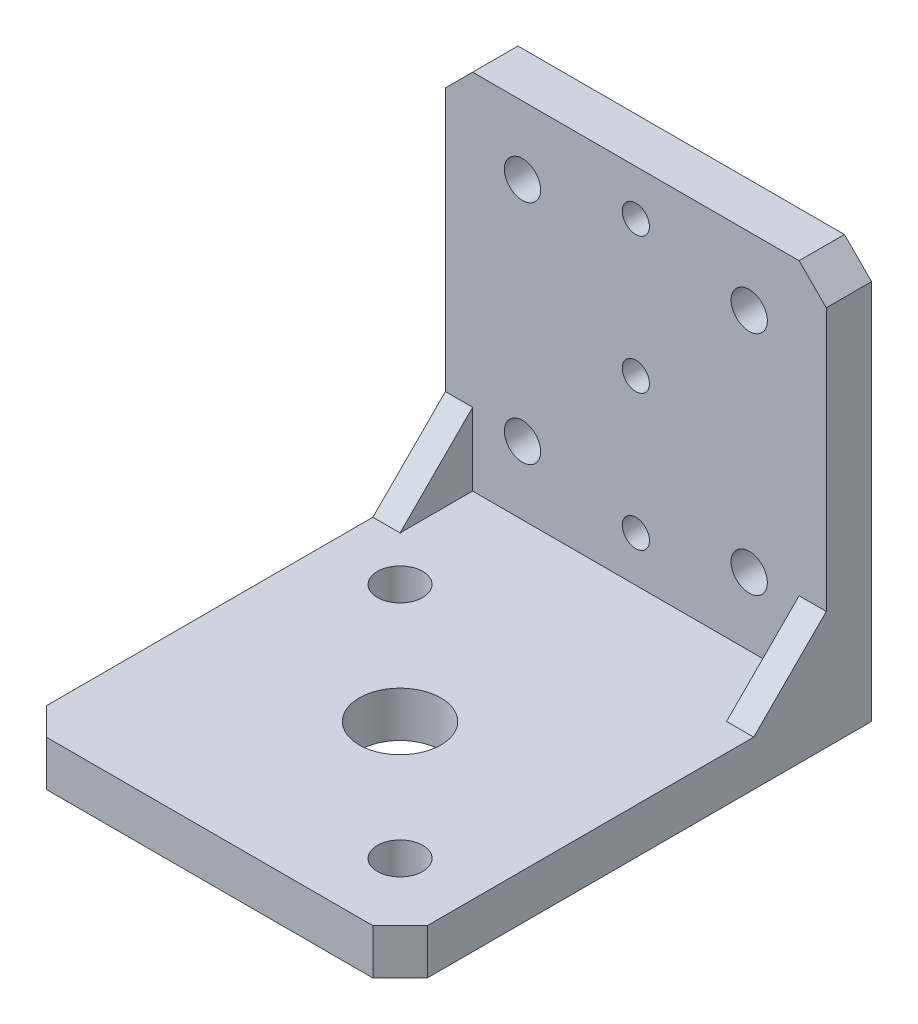
from build123d import *

# Parameters (mm, degrees)
SKETCH1_W           = 42
SKETCH1_H           = 47
BOSS_EXTRUDE1_DEPTH = 5
SKETCH4_W           = 42
SKETCH4_H           = 45
BOSS_EXTRUDE2_DEPTH = 5
BOSS_EXTRUDE3_DEPTH = 3
BOSS_EXTRUDE4_DEPTH = 3
SKETCH2_R           = 2.5
SKETCH2_R_2         = 4.5
CUT_EXTRUDE1_DEPTH  = 54.415821626
SKETCH9_R           = 2
CUT_EXTRUDE4_DEPTH  = 69.373971656
CHAMFER2_SIZE       = 3
CUT_EXTRUDE5_REACH  = 73.903
SKETCH10_R          = 1.5


with BuildPart() as part:
    # Sketch1 → Boss-Extrude1 (new body)
    with BuildSketch(Plane(origin=(0, 0, 0), x_dir=(1, 0, 0), z_dir=(0, 1, 0))):
        Rectangle(SKETCH1_W, SKETCH1_H)
    extrude(amount=BOSS_EXTRUDE1_DEPTH)

    # Sketch4 → Boss-Extrude2 (add)
    with BuildSketch(Plane(origin=(0, 0, -23.5), x_dir=(-1, 0, 0), z_dir=(0, 0, -1))):
        with Locations((0, 22.5)):
            Rectangle(SKETCH4_W, SKETCH4_H)
    extrude(amount=BOSS_EXTRUDE2_DEPTH)

    # Sketch5 → Boss-Extrude3 (add)
    with BuildSketch(Plane(origin=(21, 0, 0), x_dir=(0, 0, -1), z_dir=(1, 0, 0))):
        Polygon((23.5, 13), (15.5, 5), (23.5, 5), align=None)
    extrude(amount=-BOSS_EXTRUDE3_DEPTH)

    # Sketch6 → Boss-Extrude4 (add)
    with BuildSketch(Plane.ZY.offset(21)):
        Polygon((-23.5, 13), (-15.5, 5), (-23.5, 5), align=None)
    extrude(amount=-BOSS_EXTRUDE4_DEPTH)

    # Sketch2 → Cut-Extrude1 (cut, through all)
    with BuildSketch(Plane(origin=(0, 5, 0), x_dir=(1, 0, 0), z_dir=(0, 1, 0))):
        with Locations(Location((-13.081475452, 10.581475452, 0), (0, 0, 270))):
            Circle(SKETCH2_R)
        with Locations(Location((13.081475452, -15.581475452, 0), (0, 0, 270))):
            Circle(SKETCH2_R)
        with Locations(Location((0, -2.5, 0), (0, 0, 270))):
            Circle(SKETCH2_R_2)
    extrude(amount=-CUT_EXTRUDE1_DEPTH, mode=Mode.SUBTRACT)

    # Sketch9 → Cut-Extrude4 (cut, through all)
    with BuildSketch(Plane.XY.offset(-23.5)):
        with Locations((-12.5, 37.5)):
            Circle(SKETCH9_R)
        with Locations((12.5, 37.5)):
            Circle(SKETCH9_R)
        with Locations((12.5, 12.5)):
            Circle(SKETCH9_R)
        with Locations((-12.5, 12.5)):
            Circle(SKETCH9_R)
    extrude(amount=-CUT_EXTRUDE4_DEPTH, mode=Mode.SUBTRACT)

    # Chamfer2
    chamfer2_edges = [part.edges().sort_by_distance(p)[0] for p in [
        (-21, 2.5, 23.5),
        (21, 2.5, 23.5),
        (21, 45, -26),
        (-21, 45, -26),
    ]]
    chamfer(chamfer2_edges, length=CHAMFER2_SIZE)

    # Sketch10 → Cut-Extrude5 (cut, up to next)
    with BuildSketch(Plane(origin=(0, 0, -28.5), x_dir=(-1, 0, 0), z_dir=(0, 0, -1)), mode=Mode.PRIVATE) as cut_extrude5_sk1:
        with Locations((0, 25)):
            Circle(SKETCH10_R)
    cut_extrude5_tool1 = extrude(cut_extrude5_sk1.sketch, amount=-CUT_EXTRUDE5_REACH, mode=Mode.PRIVATE) & part.part
    # Sketch10 → Cut-Extrude5 (cut, up to next)
    with BuildSketch(Plane(origin=(0, 0, -28.5), x_dir=(-1, 0, 0), z_dir=(0, 0, -1)), mode=Mode.PRIVATE) as cut_extrude5_sk2:
        with Locations((0, 10)):
            Circle(SKETCH10_R)
    cut_extrude5_tool2 = extrude(cut_extrude5_sk2.sketch, amount=-CUT_EXTRUDE5_REACH, mode=Mode.PRIVATE) & part.part
    # Sketch10 → Cut-Extrude5 (cut, up to next)
    with BuildSketch(Plane(origin=(0, 0, -28.5), x_dir=(-1, 0, 0), z_dir=(0, 0, -1)), mode=Mode.PRIVATE) as cut_extrude5_sk3:
        with Locations((0, 40)):
            Circle(SKETCH10_R)
    cut_extrude5_tool3 = extrude(cut_extrude5_sk3.sketch, amount=-CUT_EXTRUDE5_REACH, mode=Mode.PRIVATE) & part.part
    add(cut_extrude5_tool1.solids().sort_by_distance((0, 25, -28.5))[0], mode=Mode.SUBTRACT)
    add(cut_extrude5_tool2.solids().sort_by_distance((0, 10, -28.5))[0], mode=Mode.SUBTRACT)
    add(cut_extrude5_tool3.solids().sort_by_distance((0, 40, -28.5))[0], mode=Mode.SUBTRACT)


solid = part.part
